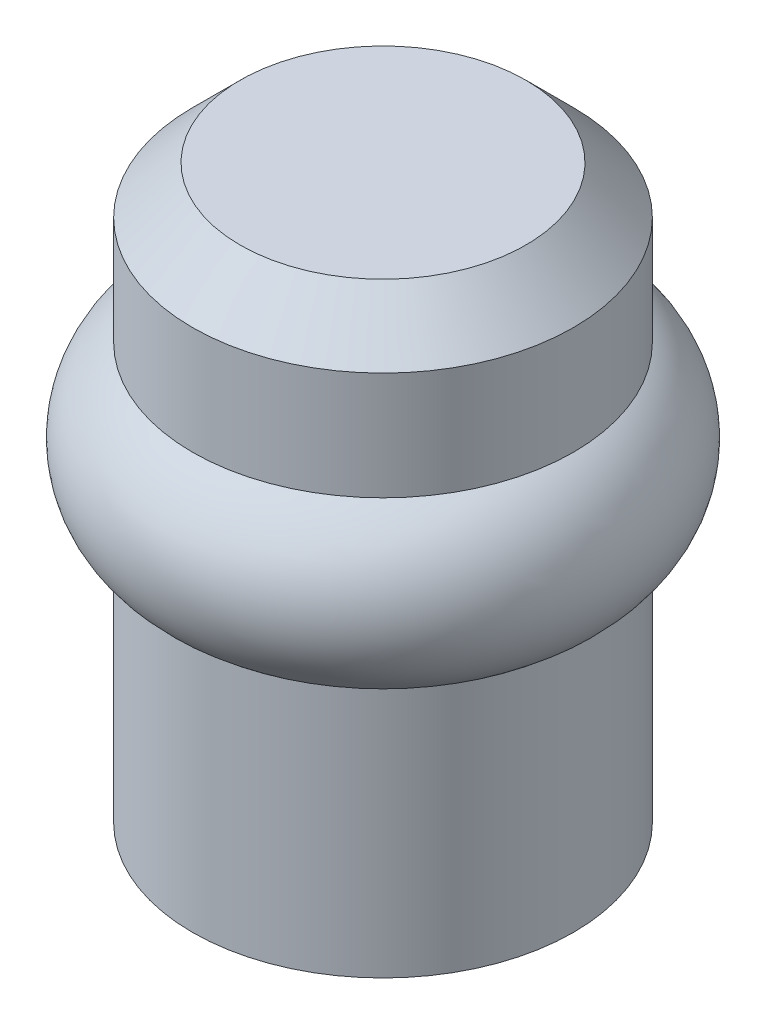
from build123d import *


with BuildPart() as part:
    # Sketch1 → Revolve1 (revolve)
    with BuildSketch(Plane.XY, mode=Mode.PRIVATE) as revolve1_sk:
        with BuildLine():
            Line((0, 0), (-25.4, 0))
            Line((-25.4, 0), (-25.4, 33.451477372))
            ThreePointArc((-25.4, 33.451477372), (-31.75, 44.45), (-25.4, 55.448522628))
            Line((-25.4, 55.448522628), (-25.4, 69.85))
            Line((-25.4, 69.85), (-19.05, 76.2))
            Line((-19.05, 76.2), (0, 76.2))
            Line((0, 76.2), (0, 0))
        make_face()
    revolve(revolve1_sk.sketch.rotate(Axis((0, 0, 0), (0, 1, 0)), 270), axis=Axis((0, 0, 0), (0, 1, 0)))


solid = part.part
